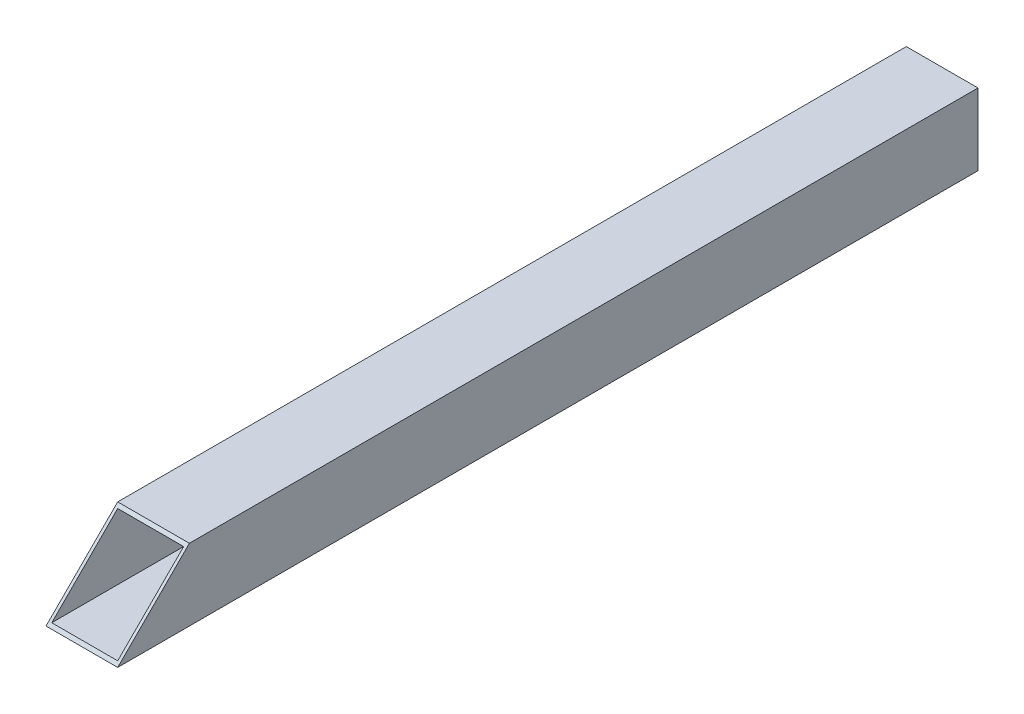
from build123d import *

# Parameters (mm, degrees)
SKETCH1_W           = 25
SKETCH1_H           = 25
SKETCH1_W_2         = 23
SKETCH1_H_2         = 23
BOSS_EXTRUDE1_DEPTH = 300
CUT_EXTRUDE1_DEPTH  = 302.29926983


with BuildPart() as part:
    # Sketch1 → Boss-Extrude1 (new body)
    with BuildSketch(Plane.XY):
        Rectangle(SKETCH1_W, SKETCH1_H)
        Rectangle(SKETCH1_W_2, SKETCH1_H_2, mode=Mode.SUBTRACT)
    extrude(amount=BOSS_EXTRUDE1_DEPTH)

    # Sketch2 → Cut-Extrude1 (cut, through all)
    with BuildSketch(Plane(origin=(12.5, 0, 0), x_dir=(0, 0, -1), z_dir=(1, 0, 0))):
        Polygon((-300, -12.5), (-275, 12.5), (-300, 12.5), align=None)
    extrude(amount=-CUT_EXTRUDE1_DEPTH, mode=Mode.SUBTRACT)


solid = part.part
